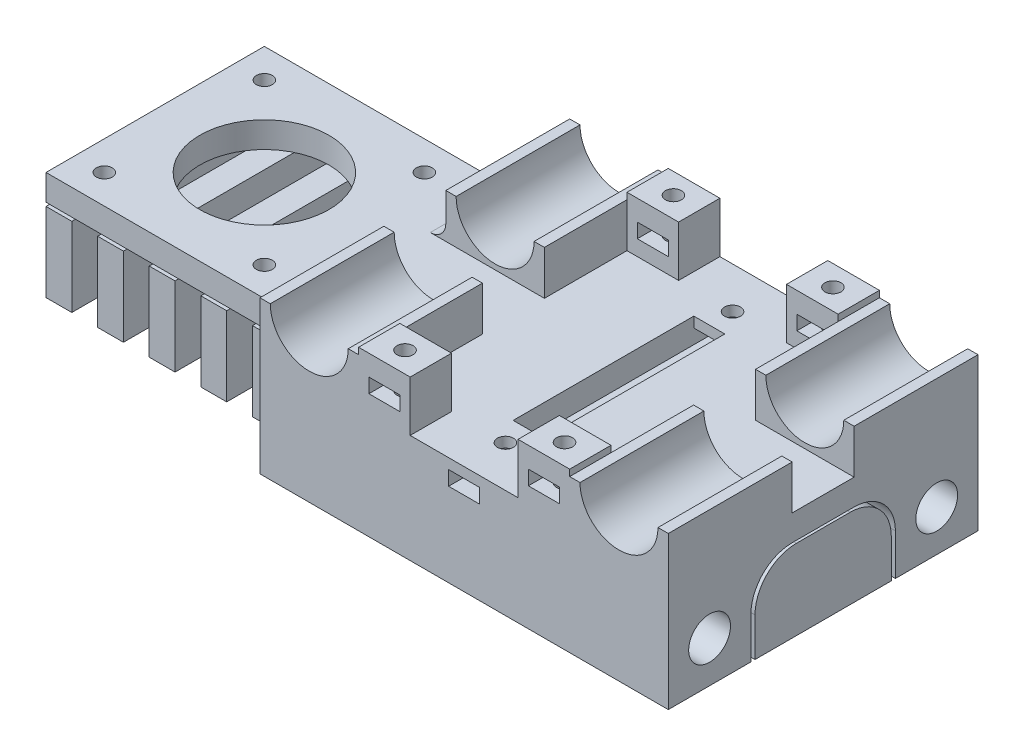
from build123d import *

# Parameters (mm, degrees)
SKETCH1_W                 = 79.1
SKETCH1_H                 = 60
BOSS_EXTRUDE1_DEPTH       = 5
BOSS_EXTRUDE2_DEPTH       = 24
MIRROR2_COPY_1_DEPTH      = 24
SKETCH9_W                 = 10
SKETCH9_H                 = 9.8
SKETCH9_W_2               = 6
SKETCH9_H_2               = 2.8
BOSS_EXTRUDE4_DEPTH       = 8
MIRROR9_COPY_1_SKETCH_W   = 10
MIRROR9_COPY_1_SKETCH_H   = 9.8
MIRROR9_COPY_1_SKETCH_W_2 = 6
MIRROR9_COPY_1_SKETCH_H_2 = 2.8
MIRROR9_COPY_1_DEPTH      = 8
SKETCH10_R                = 1.55
CUT_EXTRUDE6_DEPTH        = 52.800024131
SKETCH11_W                = 79.1
SKETCH11_H                = 16
BOSS_EXTRUDE5_DEPTH       = 16
SKETCH12_R                = 4.05
CUT_EXTRUDE7_DEPTH        = 87.097677088
SKETCH13_W                = 6
SKETCH13_H                = 2.8
CUT_EXTRUDE8_DEPTH        = 74.622024558
SKETCH14_R                = 1.55
CUT_EXTRUDE9_DEPTH        = 10
SKETCH14_3_W              = 6
SKETCH14_3_H              = 35
CUT_EXTRUDE10_DEPTH       = 4.8
FILLET1_R                 = 8
SKETCH15_W                = 50.3
SKETCH15_H                = 42.3
SKETCH15_R                = 1.55
SKETCH15_R_2              = 12.5
BOSS_EXTRUDE6_DEPTH       = 5
FILLET3_R                 = 3
SKETCH16_W                = 5
SKETCH16_H                = 42.3
BOSS_EXTRUDE7_DEPTH       = 15.3
BOSS_EXTRUDE7_2_DEPTH     = 15.3
BOSS_EXTRUDE7_3_DEPTH     = 15.3
BOSS_EXTRUDE7_4_DEPTH     = 15.3
BOSS_EXTRUDE7_5_DEPTH     = 15.3
BOSS_EXTRUDE8_DEPTH       = 5
LPATTERN1_COUNT           = 5
LPATTERN1_PITCH           = 18.5


with BuildPart() as part:
    # Sketch1 → Boss-Extrude1 (new body)
    with BuildSketch(Plane(origin=(0, 0, 0), x_dir=(1, 0, 0), z_dir=(0, 1, 0))):
        Rectangle(SKETCH1_W, SKETCH1_H)
    extrude(amount=BOSS_EXTRUDE1_DEPTH)

    # Sketch2 → Boss-Extrude2 (add)
    with BuildSketch(Plane.XY.offset(30)):
        with BuildLine():
            Line((-39.55, 13.55), (-39.55, 5))
            Line((-39.55, 5), (-20.45, 5))
            Line((-20.45, 5), (-20.45, 13.55))
            Line((-20.45, 13.55), (-22.45, 13.55))
            ThreePointArc((-22.45, 13.55), (-30, 6), (-37.55, 13.55))
            Line((-37.55, 13.55), (-39.55, 13.55))
        make_face()
    boss_extrude2 = extrude(amount=-BOSS_EXTRUDE2_DEPTH)

    # Mirror1: Boss-Extrude2 across plane
    add(boss_extrude2.mirror(Plane.XY))

    # Mirror2: Boss-Extrude2 across plane
    add(boss_extrude2.mirror(Plane(origin=(0, 0, 0), x_dir=(0, 0, 1), z_dir=(1, 0, 0))))

    # Mirror2 copy 1 sketch → Mirror2 copy 1 (add)
    with BuildSketch(Plane(origin=(0, 0, -30), x_dir=(-1, 0, 0), z_dir=(0, 0, -1))):
        with BuildLine():
            Line((-39.55, 13.55), (-39.55, 5))
            Line((-39.55, 5), (-20.45, 5))
            Line((-20.45, 5), (-20.45, 13.55))
            Line((-20.45, 13.55), (-22.45, 13.55))
            ThreePointArc((-22.45, 13.55), (-30, 6), (-37.55, 13.55))
            Line((-37.55, 13.55), (-39.55, 13.55))
        make_face()
    extrude(amount=-MIRROR2_COPY_1_DEPTH)

    # Sketch9 → Boss-Extrude4 (add)
    with BuildSketch(Plane.XY.offset(30)):
        with Locations((-15.45, 9.9)):
            Rectangle(SKETCH9_W, SKETCH9_H)
        with Locations((-15.45, 9.4)):
            Rectangle(SKETCH9_W_2, SKETCH9_H_2, mode=Mode.SUBTRACT)
    boss_extrude4 = extrude(amount=-BOSS_EXTRUDE4_DEPTH)

    # Mirror8: Boss-Extrude4 across plane
    add(boss_extrude4.mirror(Plane(origin=(0, 0, 0), x_dir=(0, 0, 1), z_dir=(1, 0, 0))))

    # Mirror9: Boss-Extrude4 across plane
    add(boss_extrude4.mirror(Plane.XY))

    # Mirror9 copy 1 sketch → Mirror9 copy 1 (add)
    with BuildSketch(Plane(origin=(0, 0, -30), x_dir=(-1, 0, 0), z_dir=(0, 0, -1))):
        with Locations((-15.45, 9.9)):
            Rectangle(MIRROR9_COPY_1_SKETCH_W, MIRROR9_COPY_1_SKETCH_H)
        with Locations((-15.45, 9.4)):
            Rectangle(MIRROR9_COPY_1_SKETCH_W_2, MIRROR9_COPY_1_SKETCH_H_2, mode=Mode.SUBTRACT)
    extrude(amount=-MIRROR9_COPY_1_DEPTH)

    # Sketch10 → Cut-Extrude6 (cut, through all)
    with BuildSketch(Plane(origin=(0, 14.8, 0), x_dir=(1, 0, 0), z_dir=(0, 1, 0))):
        with Locations(Location((-15.45, 26, 0), (0, 0, 270))):
            Circle(SKETCH10_R)
        with Locations(Location((15.45, 26, 0), (0, 0, 270))):
            Circle(SKETCH10_R)
        with Locations(Location((15.45, -26, 0), (0, 0, 270))):
            Circle(SKETCH10_R)
        with Locations(Location((-15.45, -26, 0), (0, 0, 270))):
            Circle(SKETCH10_R)
    extrude(amount=-CUT_EXTRUDE6_DEPTH, mode=Mode.SUBTRACT)

    # Sketch11 → Boss-Extrude5 (add)
    with BuildSketch(Plane.XZ):
        with Locations((0, 22)):
            Rectangle(SKETCH11_W, SKETCH11_H)
        with Locations((0, -22)):
            Rectangle(SKETCH11_W, SKETCH11_H)
    extrude(amount=BOSS_EXTRUDE5_DEPTH)

    # Sketch12 → Cut-Extrude7 (cut, through all)
    with BuildSketch(Plane(origin=(39.55, 0, 0), x_dir=(0, 0, -1), z_dir=(1, 0, 0))):
        with Locations((-22, -8)):
            Circle(SKETCH12_R)
        with Locations((22, -8)):
            Circle(SKETCH12_R)
    extrude(amount=-CUT_EXTRUDE7_DEPTH, mode=Mode.SUBTRACT)

    # Sketch13 → Cut-Extrude8 (cut, through all)
    with BuildSketch(Plane(origin=(0, 0, -30), x_dir=(-1, 0, 0), z_dir=(0, 0, -1))):
        with Locations((0, 1.6)):
            Rectangle(SKETCH13_W, SKETCH13_H)
    extrude(amount=-CUT_EXTRUDE8_DEPTH, mode=Mode.SUBTRACT)

    # Sketch14 → Cut-Extrude9 (cut)
    with BuildSketch(Plane(origin=(0, 5, 0), x_dir=(1, 0, 0), z_dir=(0, 1, 0))):
        with Locations(Location((0, -22, 0), (0, 0, 270))):
            Circle(SKETCH14_R)
        with Locations(Location((0, 22, 0), (0, 0, 270))):
            Circle(SKETCH14_R)
    extrude(amount=-CUT_EXTRUDE9_DEPTH, mode=Mode.SUBTRACT)

    # Sketch14<3> → Cut-Extrude10 (cut)
    with BuildSketch(Plane(origin=(0, 5, 0), x_dir=(1, 0, 0), z_dir=(0, 1, 0))):
        Rectangle(SKETCH14_3_W, SKETCH14_3_H)
    extrude(amount=-CUT_EXTRUDE10_DEPTH, mode=Mode.SUBTRACT)

    # Fillet1
    fillet1_edges = [part.edges().sort_by_distance(p)[0] for p in [
        (0, 0, -14),
        (0, 0, 14),
    ]]
    fillet(fillet1_edges, radius=FILLET1_R)

    # Sketch15 → Boss-Extrude6 (add)
    with BuildSketch(Plane.XZ):
        with Locations((-64.7, 0)):
            Rectangle(SKETCH15_W, SKETCH15_H)
        with Locations(Location((-84.2, 15.5, 0), (0, 0, 270))):
            Circle(SKETCH15_R, mode=Mode.SUBTRACT)
        with Locations(Location((-84.2, -15.5, 0), (0, 0, 270))):
            Circle(SKETCH15_R, mode=Mode.SUBTRACT)
        with Locations(Location((-53.2, -15.5, 0), (0, 0, 270))):
            Circle(SKETCH15_R, mode=Mode.SUBTRACT)
        with Locations(Location((-53.2, 15.5, 0), (0, 0, 270))):
            Circle(SKETCH15_R, mode=Mode.SUBTRACT)
        with Locations(Location((-68.7, 0, 0), (0, 0, 270))):
            Circle(SKETCH15_R_2, mode=Mode.SUBTRACT)
    extrude(amount=-BOSS_EXTRUDE6_DEPTH)

    # Fillet3
    fillet3_edges = [part.edges().sort_by_distance(p)[0] for p in [
        (-39.55, 5, -13.575),
        (-39.55, 5, 13.575),
    ]]
    fillet(fillet3_edges, radius=FILLET3_R)


with BuildPart() as body_2:
    # Sketch16 → Boss-Extrude7 (new body)
    with BuildSketch(Plane(origin=(0, -0.7, 0), x_dir=(-1, 0, 0), z_dir=(0, -1, 0))):
        with Locations((87.35, 0)):
            Rectangle(SKETCH16_W, SKETCH16_H)
    extrude(amount=BOSS_EXTRUDE7_DEPTH)


with BuildPart() as body_3:
    # Sketch16 → Boss-Extrude7 2 (new body)
    with BuildSketch(Plane(origin=(0, -0.7, 0), x_dir=(-1, 0, 0), z_dir=(0, -1, 0))):
        with Locations((77.35, 0)):
            Rectangle(SKETCH16_W, SKETCH16_H)
    extrude(amount=BOSS_EXTRUDE7_2_DEPTH)


with BuildPart() as body_4:
    # Sketch16 → Boss-Extrude7 3 (new body)
    with BuildSketch(Plane(origin=(0, -0.7, 0), x_dir=(-1, 0, 0), z_dir=(0, -1, 0))):
        with Locations((67.35, 0)):
            Rectangle(SKETCH16_W, SKETCH16_H)
    extrude(amount=BOSS_EXTRUDE7_3_DEPTH)


with BuildPart() as body_5:
    # Sketch16 → Boss-Extrude7 4 (new body)
    with BuildSketch(Plane(origin=(0, -0.7, 0), x_dir=(-1, 0, 0), z_dir=(0, -1, 0))):
        with Locations((57.35, 0)):
            Rectangle(SKETCH16_W, SKETCH16_H)
    extrude(amount=BOSS_EXTRUDE7_4_DEPTH)


with BuildPart() as body_6:
    # Sketch16 → Boss-Extrude7 5 (new body)
    with BuildSketch(Plane(origin=(0, -0.7, 0), x_dir=(-1, 0, 0), z_dir=(0, -1, 0))):
        with Locations((47.35, 0)):
            Rectangle(SKETCH16_W, SKETCH16_H)
    extrude(amount=BOSS_EXTRUDE7_5_DEPTH)


with BuildPart() as body_7:
    # Sketch17 → Boss-Extrude8 (new body)
    with BuildSketch(Plane(origin=(39.55, 0, 0), x_dir=(0, 0, -1), z_dir=(1, 0, 0))):
        with BuildLine():
            Line((-13.2, -16), (13.2, -16))
            Line((13.2, -16), (13.2, -8.5))
            ThreePointArc((13.2, -8.5), (10.856854249, -2.843145751), (5.2, -0.5))
            Line((5.2, -0.5), (-5.2, -0.5))
            ThreePointArc((-5.2, -0.5), (-10.856854249, -2.843145751), (-13.2, -8.5))
            Line((-13.2, -8.5), (-13.2, -16))
        make_face()
    boss_extrude8 = extrude(amount=-BOSS_EXTRUDE8_DEPTH)


with BuildPart() as lpattern1_1:
    # LPattern1: Boss-Extrude8 ×5
    with Locations(*[(-i * LPATTERN1_PITCH, 0, 0) for i in range(1, LPATTERN1_COUNT)]):
        add(boss_extrude8)


solid = Compound([part.part, body_2.part, body_3.part, body_4.part, body_5.part, body_6.part, body_7.part, lpattern1_1.part])
